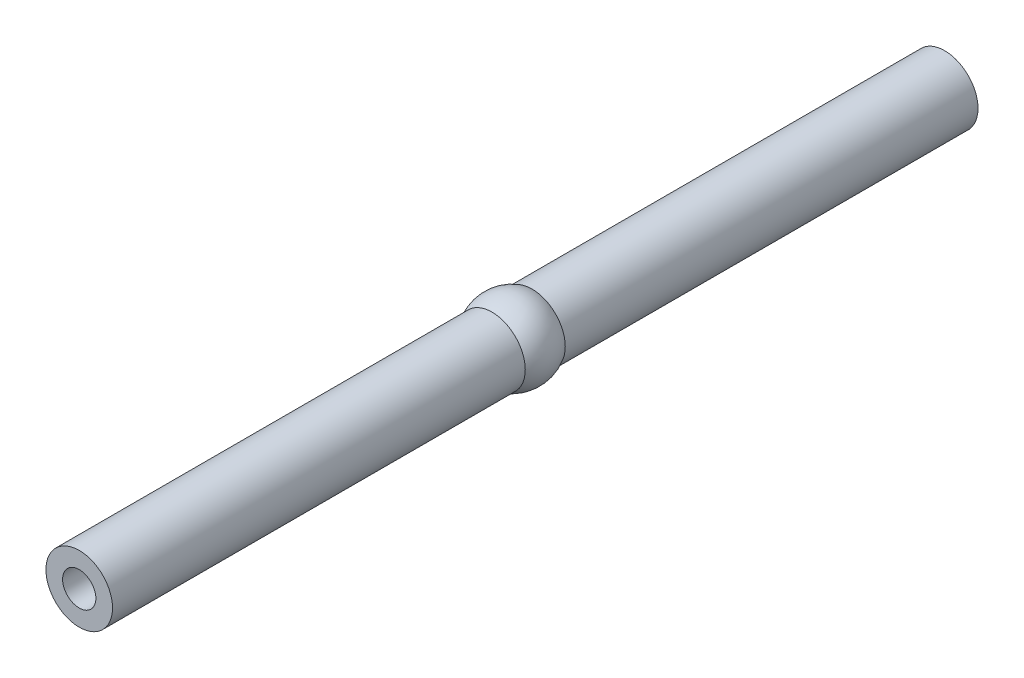
from build123d import *

# Parameters (mm, degrees)
ESQUISSE1_R             = 3
EXTRUSION1_DEPTH        = 39
ESQUISSE2_R             = 1.5
ENL_V_MAT_EXTRU_1_DEPTH = 10


with BuildPart() as part:
    # Esquisse1 → Extrusion1 (new, symmetric)
    with BuildSketch(Plane.XY):
        Circle(ESQUISSE1_R)
    extrude(amount=EXTRUSION1_DEPTH, both=True)

    # Esquisse2 → Enlèv. mat.-Extru.1 (cut)
    with BuildSketch(Plane.XY.offset(39)):
        Circle(ESQUISSE2_R)
    enl_v_mat_extru_1 = extrude(amount=-ENL_V_MAT_EXTRU_1_DEPTH, mode=Mode.SUBTRACT)

    # Symétrie1: Enlèv. mat.-Extru.1 across plane
    add(enl_v_mat_extru_1.mirror(Plane.XY), mode=Mode.SUBTRACT)

    # Esquisse3 → Révolution1 (revolve)
    with BuildSketch(Plane(origin=(0, 0, 0), x_dir=(1, 0, 0), z_dir=(0, 1, 0))):
        with BuildLine():
            Line((0, 3.5), (0, -3.5))
            ThreePointArc((0, -3.5), (3.5, 0), (0, 3.5))
        make_face()
    revolve(axis=Axis((0, 0, -41.019136627), (0, 0, 1)))


solid = part.part
